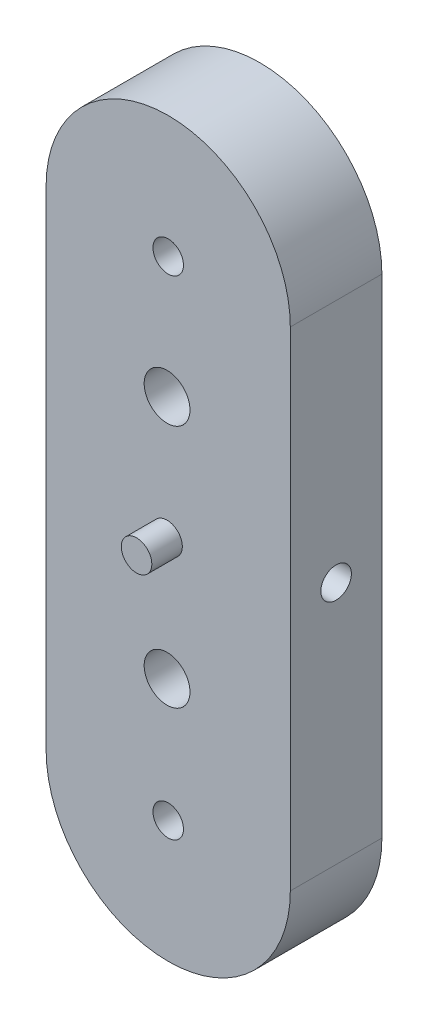
from build123d import *

# Parameters (mm, degrees)
BOSS_EXTRUDE1_DEPTH = 38.1
SKETCH2_R           = 6.35
CUT_EXTRUDE1_DEPTH  = 277.206752271
SKETCH3_R           = 9.525
CUT_EXTRUDE3_DEPTH  = 35.56
SKETCH5_R           = 6.35
BOSS_EXTRUDE2_DEPTH = 12.7
SKETCH6_R           = 6.35
CUT_EXTRUDE4_DEPTH  = 279.243059213


with BuildPart() as part:
    # Sketch1 → Boss-Extrude1 (new body)
    with BuildSketch(Plane.XY):
        with BuildLine():
            Line((0, 0), (0, 203.2))
            ThreePointArc((0, 203.2), (50.8, 254), (101.6, 203.2))
            Line((101.6, 203.2), (101.6, 0))
            ThreePointArc((101.6, 0), (50.8, -50.8), (0, 0))
        make_face()
    extrude(amount=BOSS_EXTRUDE1_DEPTH)

    # Sketch2 → Cut-Extrude1 (cut, through all)
    with BuildSketch(Plane.XY.offset(38.1)):
        with Locations((50.8, 203.2)):
            Circle(SKETCH2_R)
        with Locations((50.8, 0)):
            Circle(SKETCH2_R)
    extrude(amount=-CUT_EXTRUDE1_DEPTH, mode=Mode.SUBTRACT)

    # Sketch3 → Cut-Extrude3 (cut)
    with BuildSketch(Plane.XY.offset(38.1)):
        with Locations((50.327847378, 152.4)):
            Circle(SKETCH3_R)
        with Locations((50.327847378, 50.8)):
            Circle(SKETCH3_R)
    extrude(amount=-CUT_EXTRUDE3_DEPTH, mode=Mode.SUBTRACT)

    # Sketch5 → Boss-Extrude2 (add)
    with BuildSketch(Plane.XY.offset(38.1)):
        with Locations((50.327847378, 101.6)):
            Circle(SKETCH5_R)
    extrude(amount=BOSS_EXTRUDE2_DEPTH)

    # Sketch6 → Cut-Extrude4 (cut, through all)
    with BuildSketch(Plane(origin=(101.6, 0, 0), x_dir=(0, 0, -1), z_dir=(1, 0, 0))):
        with Locations((-19.05, 101.6)):
            Circle(SKETCH6_R)
    extrude(amount=-CUT_EXTRUDE4_DEPTH, mode=Mode.SUBTRACT)


solid = part.part
